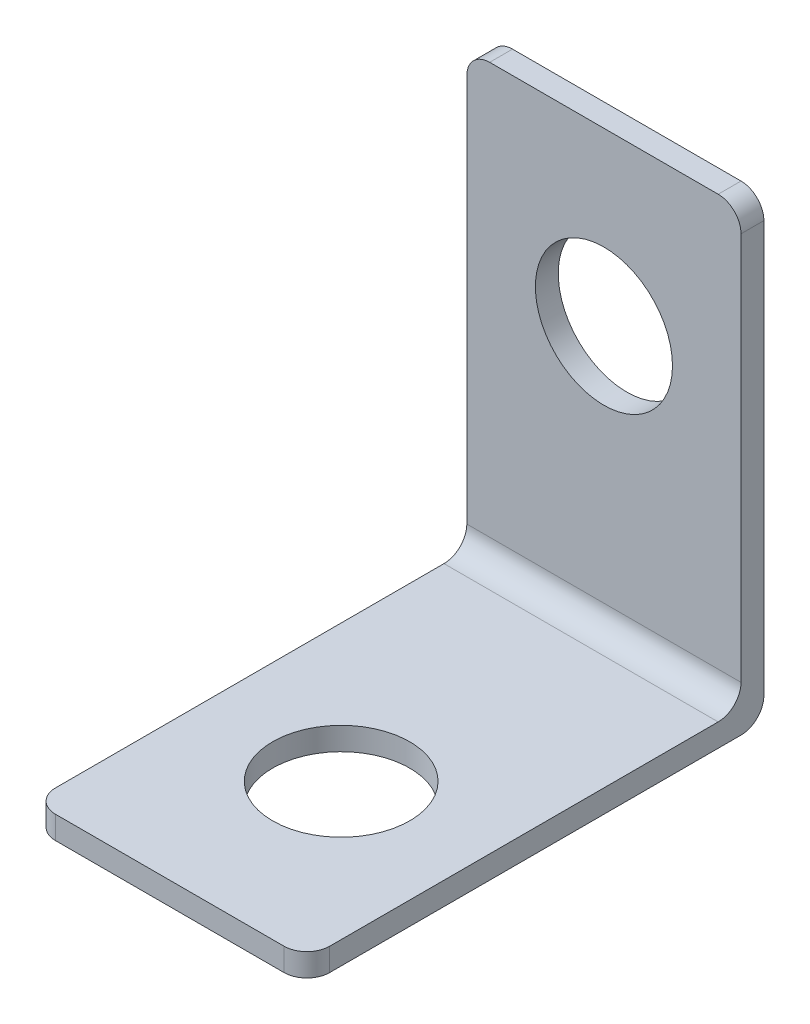
from build123d import *

# Parameters (mm, degrees)
ESQUISSE1_W             = 12
ESQUISSE1_H             = 20
ESQUISSE1_R             = 3
BOSS_EXTRU_1_DEPTH      = 1
ESQUISSE2_W             = 12
ESQUISSE2_H             = 1
BOSS_EXTRU_2_DEPTH      = 19
ESQUISSE3_R             = 3
ENL_V_MAT_EXTRU_1_DEPTH = 19
CONG_1_R                = 1
CONG_2_R                = 1


with BuildPart() as part:
    # Esquisse1 → Boss.-Extru.1 (new body)
    with BuildSketch(Plane.XY):
        with Locations((0, 10)):
            Rectangle(ESQUISSE1_W, ESQUISSE1_H)
        with Locations((0, 12.5)):
            Circle(ESQUISSE1_R, mode=Mode.SUBTRACT)
    extrude(amount=BOSS_EXTRU_1_DEPTH)

    # Esquisse2 → Boss.-Extru.2 (add)
    with BuildSketch(Plane.XY.offset(1)):
        with Locations((0, 0.5)):
            Rectangle(ESQUISSE2_W, ESQUISSE2_H)
    extrude(amount=BOSS_EXTRU_2_DEPTH)

    # Esquisse3 → Enlèv. mat.-Extru.1 (cut)
    with BuildSketch(Plane(origin=(0, 1, 0), x_dir=(1, 0, 0), z_dir=(0, 1, 0))):
        with Locations(Location((0, -12.5, 0), (0, 0, 270))):
            Circle(ESQUISSE3_R)
    extrude(amount=-ENL_V_MAT_EXTRU_1_DEPTH, mode=Mode.SUBTRACT)

    # Congé1
    cong_1_edges = [part.edges().sort_by_distance(p)[0] for p in [
        (0, 1, 1),
        (0, 0, 0),
    ]]
    fillet(cong_1_edges, radius=CONG_1_R)

    # Congé2
    cong_2_edges = [part.edges().sort_by_distance(p)[0] for p in [
        (-6, 0.5, 20),
        (6, 0.5, 20),
        (-6, 20, 0.5),
        (6, 20, 0.5),
    ]]
    fillet(cong_2_edges, radius=CONG_2_R)


solid = part.part
